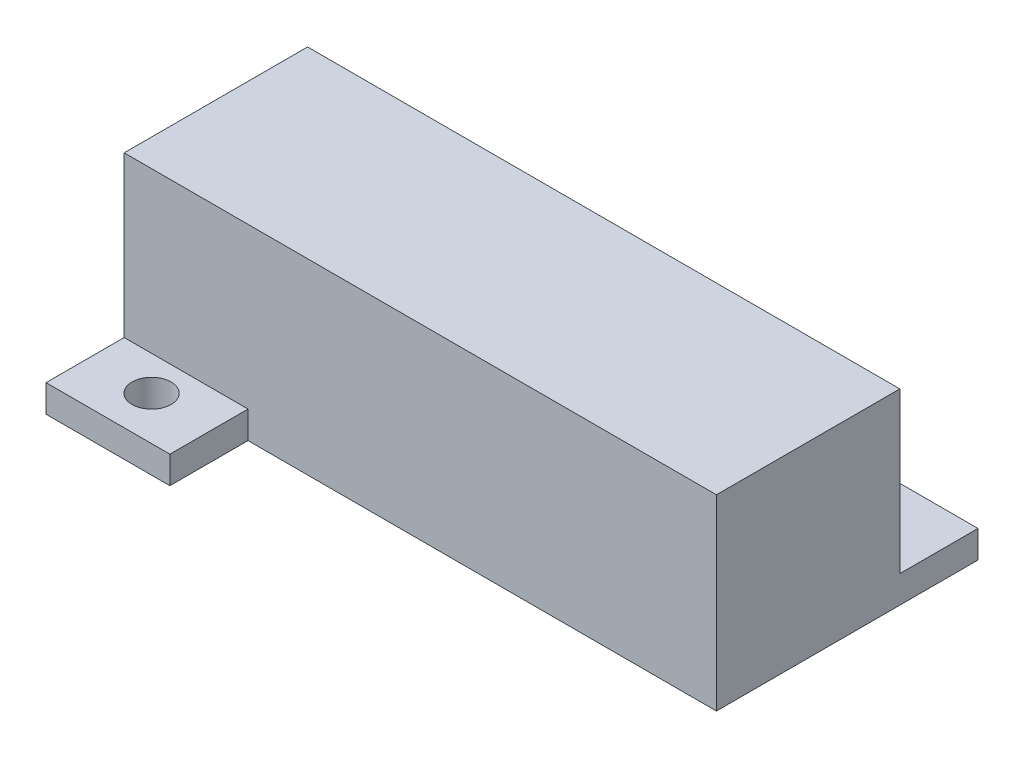
from build123d import *

# Parameters (mm, degrees)
SKETCH1_R           = 1.651
BOSS_EXTRUDE1_DEPTH = 2.3114
SKETCH2_W           = 50.038
SKETCH2_H           = 15.494
BOSS_EXTRUDE2_DEPTH = 13.5128


with BuildPart() as part:
    # Sketch1 → Boss-Extrude1 (new body)
    with BuildSketch(Plane(origin=(0, 0, 0), x_dir=(1, 0, 0), z_dir=(0, 1, 0))):
        Polygon((0, 0), (10.4648, 0), (10.4648, 6.604), (50.038, 6.604), (50.038, 28.702), (39.5732, 28.702), (39.5732, 22.098), (0, 22.098), align=None)
        with Locations(Location((5.2324, 3.683, 0), (0, 0, 270))):
            Circle(SKETCH1_R, mode=Mode.SUBTRACT)
        with Locations(Location((44.8056, 25.019, 0), (0, 0, 270))):
            Circle(SKETCH1_R, mode=Mode.SUBTRACT)
    extrude(amount=BOSS_EXTRUDE1_DEPTH)

    # Sketch2 → Boss-Extrude2 (add)
    with BuildSketch(Plane(origin=(0, 2.3114, 0), x_dir=(1, 0, 0), z_dir=(0, 1, 0))):
        with Locations((25.019, 14.351)):
            Rectangle(SKETCH2_W, SKETCH2_H)
    extrude(amount=BOSS_EXTRUDE2_DEPTH)


solid = part.part
